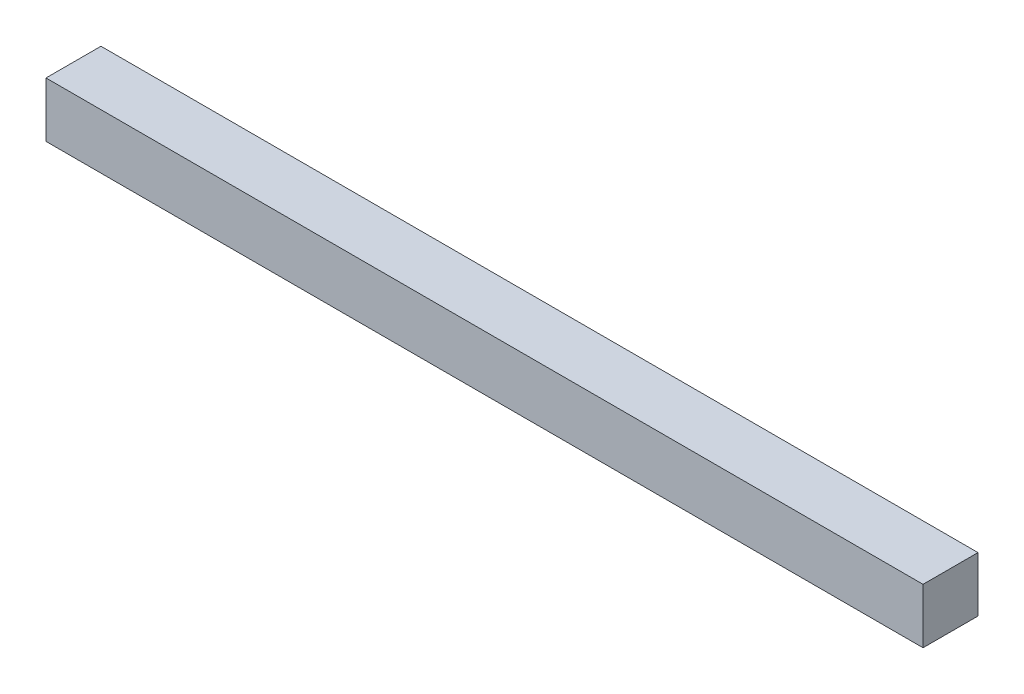
from build123d import *

# Parameters (mm, degrees)
CROQUIS1_W              = 287.21
CROQUIS1_H              = 18
SALIENTE_EXTRUIR1_DEPTH = 18


with BuildPart() as part:
    # Croquis1 → Saliente-Extruir1 (new body)
    with BuildSketch(Plane.XY):
        with Locations((143.605, -9)):
            Rectangle(CROQUIS1_W, CROQUIS1_H)
    extrude(amount=-SALIENTE_EXTRUIR1_DEPTH)


solid = part.part
